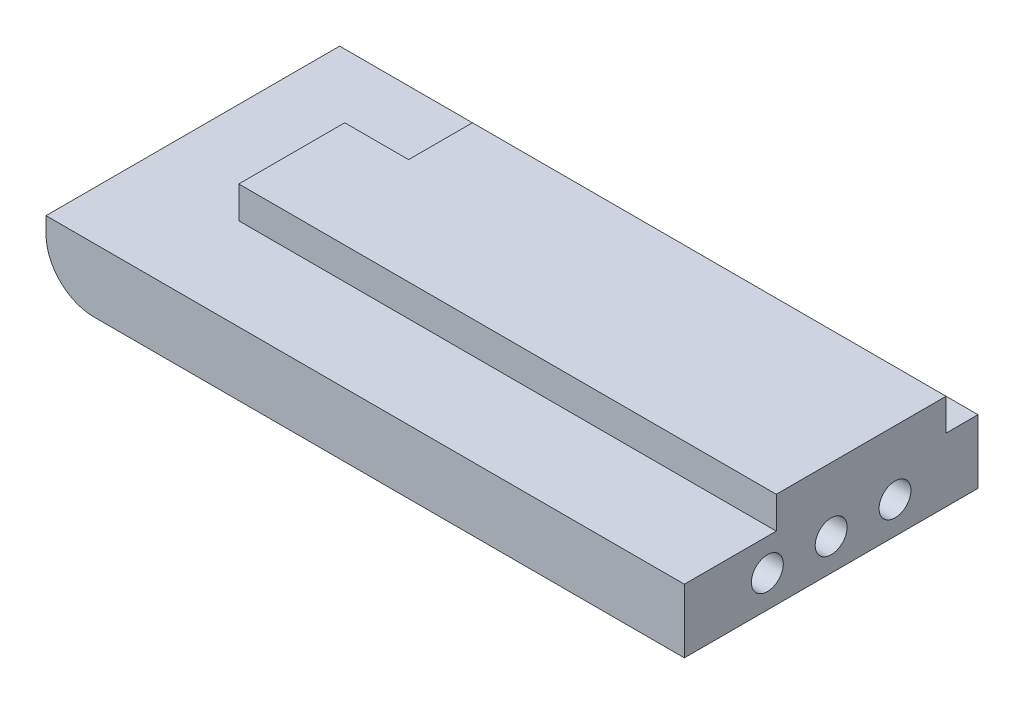
from build123d import *

# Parameters (mm, degrees)
SKETCH1_W           = 254
SKETCH1_H           = 58.42
BOSS_EXTRUDE1_DEPTH = 19.05
CUT_EXTRUDE1_DEPTH  = 6.35
FILLET1_R           = 9.525
CUT_EXTRUDE2_START  = -127
SKETCH4_W           = 63.359739346
SKETCH4_H           = 23.579054397
CUT_EXTRUDE2_DEPTH  = 127
SKETCH5_R           = 3.175
CUT_EXTRUDE3_DEPTH  = 15.24
SKETCH6_W           = 12.7
SKETCH6_H           = 21.082
BOSS_EXTRUDE2_DEPTH = 6.35


with BuildPart() as part:
    # Sketch1 → Boss-Extrude1 (new body)
    with BuildSketch(Plane(origin=(0, 0, 0), x_dir=(1, 0, 0), z_dir=(0, 1, 0))):
        with Locations((127, 29.21)):
            Rectangle(SKETCH1_W, SKETCH1_H)
    extrude(amount=BOSS_EXTRUDE1_DEPTH)

    # Sketch2 → Cut-Extrude1 (cut)
    with BuildSketch(Plane(origin=(0, 19.05, 0), x_dir=(1, 0, 0), z_dir=(0, 1, 0))):
        Polygon((221.234, 52.07), (221.234, 18.288), (127, 18.288), (127, 0), (254, 0), (254, 58.42), (127, 58.42), (127, 52.07), align=None)
        Polygon((127, 0), (127, 18.288), (32.766, 18.288), (32.766, 52.07), (127, 52.07), (127, 58.42), (0, 58.42), (0, 0), align=None)
    extrude(amount=-CUT_EXTRUDE1_DEPTH, mode=Mode.SUBTRACT)

    # Fillet1
    fillet1_edges = [part.edges().sort_by_distance(p)[0] for p in [
        (254, 0, -29.21),
        (0, 0, -29.21),
    ]]
    fillet(fillet1_edges, radius=FILLET1_R)

    # Sketch4 → Cut-Extrude2 (cut)
    with BuildSketch(Plane(origin=(254, 0, 0), x_dir=(0, 0, -1), z_dir=(1, 0, 0)).offset(CUT_EXTRUDE2_START)):
        with Locations((31.679869673, 11.789527199)):
            Rectangle(SKETCH4_W, SKETCH4_H)
    extrude(amount=CUT_EXTRUDE2_DEPTH, mode=Mode.SUBTRACT)

    # Sketch5 → Cut-Extrude3 (cut)
    with BuildSketch(Plane(origin=(127, 0, 0), x_dir=(0, 0, -1), z_dir=(1, 0, 0))):
        with Locations((16.51, 6.35)):
            Circle(SKETCH5_R)
        with Locations((29.21, 6.35)):
            Circle(SKETCH5_R)
        with Locations((41.91, 6.35)):
            Circle(SKETCH5_R)
    extrude(amount=-CUT_EXTRUDE3_DEPTH, mode=Mode.SUBTRACT)

    # Sketch6 → Boss-Extrude2 (add)
    with BuildSketch(Plane(origin=(0, 12.7, 0), x_dir=(1, 0, 0), z_dir=(0, 1, 0))):
        with Locations((26.416, 28.829)):
            Rectangle(SKETCH6_W, SKETCH6_H)
    extrude(amount=BOSS_EXTRUDE2_DEPTH)


solid = part.part
